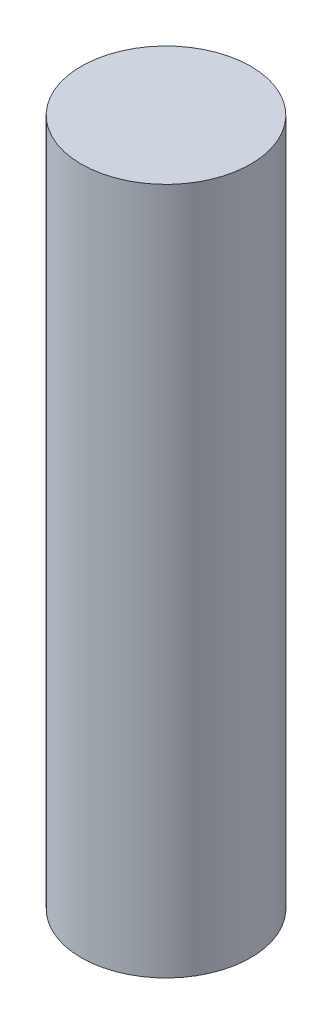
from build123d import *

# Parameters (mm, degrees)
SKETCH1_R           = 37
BOSS_EXTRUDE1_DEPTH = 300


with BuildPart() as part:
    # Sketch1 → Boss-Extrude1 (new body)
    with BuildSketch(Plane(origin=(0, 0, 0), x_dir=(1, 0, 0), z_dir=(0, 1, 0))):
        with Locations(Location((0, 0, 0), (0, 0, 270))):
            Circle(SKETCH1_R)
    extrude(amount=BOSS_EXTRUDE1_DEPTH)


solid = part.part
